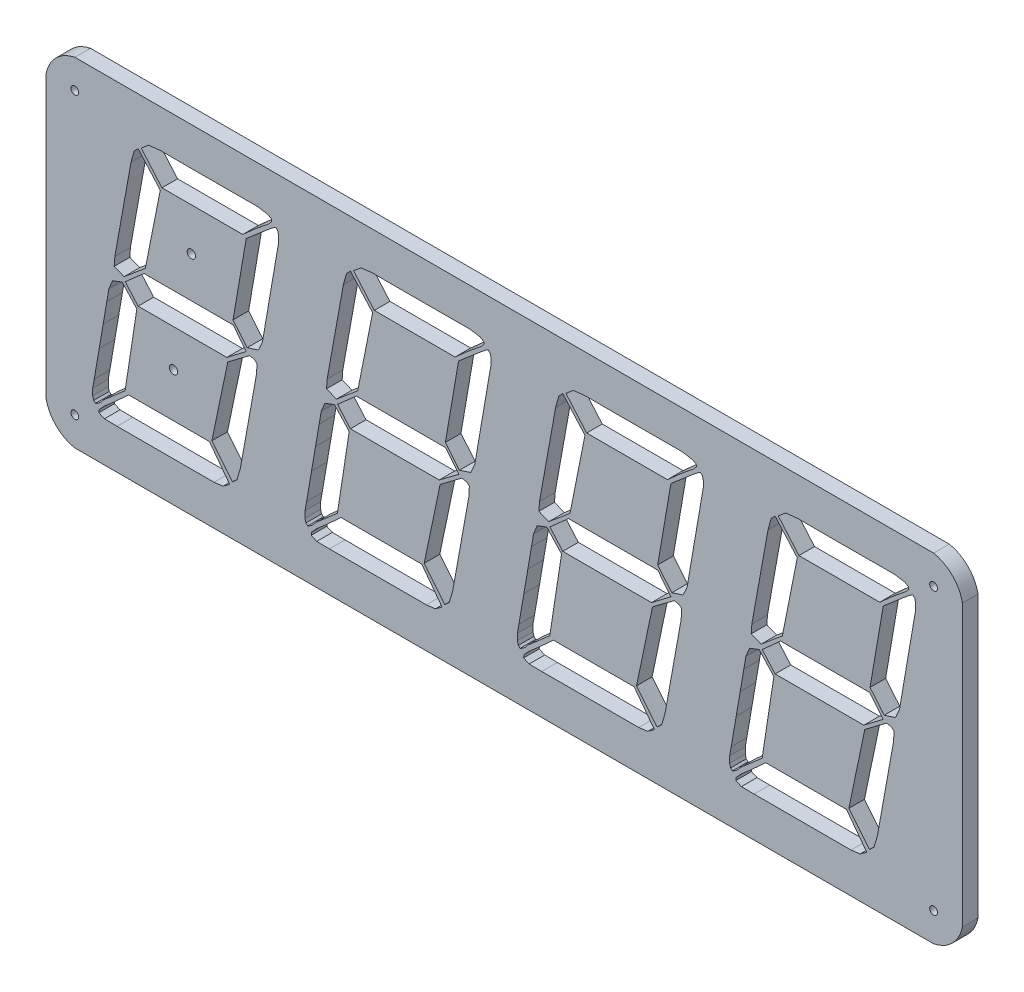
from build123d import *

# Parameters (mm, degrees)
MODEL_R                 = 1.5
MODEL_R_2               = 1.6
SALIENTE_EXTRUIR1_DEPTH = 6


with BuildPart() as part:
    # Model → Saliente-Extruir1 (new body)
    with BuildSketch(Plane.XY):
        with BuildLine():
            Line((-140.470724827, 55.674525344), (-140.470724827, -52.204727485))
            ThreePointArc((-140.470724827, -52.204727485), (-136.629245308, -59.423621552), (-129.410351241, -63.265101071))
            Line((-129.410351241, -63.265101071), (200.589648759, -63.265101071))
            ThreePointArc((200.589648759, -63.265101071), (207.808542826, -59.423621552), (211.650022344, -52.204727485))
            Line((211.650022344, -52.204727485), (211.650022344, 55.674525344))
            ThreePointArc((211.650022344, 55.674525344), (207.808542826, 62.893419411), (200.589648759, 66.734898929))
            Line((200.589648759, 66.734898929), (-129.410351241, 66.734898929))
            ThreePointArc((-129.410351241, 66.734898929), (-136.629245308, 62.893419411), (-140.470724827, 55.674525344))
        make_face()
        with Locations((-129.410351241, 55.674525344)):
            Circle(MODEL_R, mode=Mode.SUBTRACT)
        with Locations((-129.410351241, -52.232254112)):
            Circle(MODEL_R, mode=Mode.SUBTRACT)
        with Locations((200.589648759, -52.204727485)):
            Circle(MODEL_R, mode=Mode.SUBTRACT)
        with Locations((200.589648759, 55.674525344)):
            Circle(MODEL_R, mode=Mode.SUBTRACT)
        with Locations((-84.621427726, 23.674258093)):
            Circle(MODEL_R_2, mode=Mode.SUBTRACT)
        with Locations((-91.444427726, -18.252741907)):
            Circle(MODEL_R_2, mode=Mode.SUBTRACT)
        Polygon((-64.884856959, 40.039011276), (-95.922770086, 40.039011276), (-103.882551193, 49.264679304), (-101.023876189, 51.671251765), (-96.284270287, 52.176739278), (-90.706581993, 52.127820067), (-81.403433396, 52.1176096), (-71.480295888, 52.136742459), (-59.257239103, 52.179772042), (-55.252662933, 51.53218883), (-53.813979507, 50.694888149), (-53.724588788, 49.868123517), (-54.947078228, 48.507701415), (-60.024422271, 44.366939193), align=None, mode=Mode.SUBTRACT)
        Polygon((-110.03300778, 1.734898929), (-102.814876765, 8.071671701), (-68.533725838, 8.071671701), (-63.540735963, 1.734898929), (-70.992843615, -3.931820568), (-105.087782834, -3.931820568), align=None, mode=Mode.SUBTRACT)
        Polygon((-108.707083368, -35.279682173), (-77.669170242, -35.279682173), (-69.872498512, -45.652948091), (-72.416502607, -47.498902727), (-75.901031494, -47.942078344), (-113.168239594, -47.942078344), (-118.036746769, -47.892531747), (-120.137002167, -46.912762987), (-119.999276772, -45.742793724), (-117.901802063, -43.53971815), (-113.898335833, -40.046067211), align=None, mode=Mode.SUBTRACT)
        Polygon((-55.670106882, 46.108178554), (-63.540735963, 39.354819722), (-68.606058363, 9.737453244), (-63.184678555, 3.194264957), (-58.853820987, 4.586733548), (-57.298094034, 8.008171222), (-56.51592389, 12.618451892), (-55.116410552, 20.795833647), (-53.583708167, 29.72334992), (-51.669865847, 40.853005129), (-51.072887963, 44.202500304), (-51.088184118, 46.656502282), (-51.44120689, 48.048876852), (-52.14239582, 48.673896881), (-52.252566876, 48.664679591), (-52.375362447, 48.620233586), (-52.673945278, 48.459434843), (-53.460014826, 47.91262945), align=None, mode=Mode.SUBTRACT)
        Polygon((-105.072012462, 48.507701415), (-96.56147018, 38.907183759), (-102.29703342, 10.046188617), (-110.466659069, 3.194264957), (-114.26667157, 4.742709813), (-114.019879309, 8.131907993), (-107.806921005, 42.622319635), (-106.602545086, 46.96416624), align=None, mode=Mode.SUBTRACT)
        with BuildLine():
            Line((-118.525960031, -41.898386284), (-110.079105793, -34.563949873))
            Line((-110.079105793, -34.563949873), (-105.563926779, -5.130368892))
            Line((-105.563926779, -5.130368892), (-111.206650734, 1.026445264))
            Line((-111.206650734, 1.026445264), (-114.913623693, -0.375805811))
            Line((-114.913623693, -0.375805811), (-116.319894791, -3.799592058))
            Line((-116.319894791, -3.799592058), (-117.101955546, -8.409967835))
            Line((-117.101955546, -8.409967835), (-118.501040901, -16.587634913))
            Line((-118.501040901, -16.587634913), (-120.03320685, -25.515508809))
            Line((-120.03320685, -25.515508809), (-121.946275234, -36.64563907))
            Line((-121.946275234, -36.64563907), (-122.545270973, -39.993857087))
            Line((-122.545270973, -39.993857087), (-122.530400753, -42.447923117))
            Line((-122.530400753, -42.447923117), (-122.176472316, -43.840799855))
            Line((-122.176472316, -43.840799855), (-121.475626278, -44.465317717))
            ThreePointArc((-121.475626278, -44.465317717), (-119.808869122, -43.402392305), (-118.525960031, -41.898386284))
        make_face(mode=Mode.SUBTRACT)
        Polygon((-68.846147443, -44.329468953), (-76.745996886, -34.561523663), (-70.628911938, -5.255318769), (-62.274247408, 1.014314208), (-60.444587216, 0.705635699), (-59.388882074, -0.220399828), (-59.599355895, -3.924541934), (-65.812110901, -38.414366086), (-67.110061355, -42.765832133), align=None, mode=Mode.SUBTRACT)
        Polygon((16.706648759, 40.039011276), (-14.331264368, 40.039011276), (-22.291049361, 49.264679304), (-19.432370471, 51.671251765), (-14.692768455, 52.176739278), (-9.115076275, 52.127820067), (0.188072322, 52.1176096), (10.11120983, 52.136742459), (22.334232926, 52.179772042), (26.338842785, 51.53218883), (27.777526211, 50.694888149), (27.86691693, 49.868123517), (26.644408703, 48.507701415), (21.567083447, 44.366939193), align=None, mode=Mode.SUBTRACT)
        Polygon((-28.441502062, 1.734898929), (-21.223371047, 8.071671701), (13.05777988, 8.071671701), (18.174375425, 1.734898929), (10.598662103, -3.931820568), (-23.496277116, -3.931820568), align=None, mode=Mode.SUBTRACT)
        Polygon((-27.11557765, -35.279682173), (3.922335476, -35.279682173), (11.718958616, -45.652948091), (9.17500311, -47.498902727), (5.69043681, -47.942078344), (-31.576752663, -47.942078344), (-36.445241051, -47.892531747), (-38.545496449, -46.912762987), (-38.407771054, -45.742793724), (-36.31028533, -43.53971815), (-32.306830115, -40.046067211), align=None, mode=Mode.SUBTRACT)
        Polygon((25.921398836, 46.139928793), (18.050769755, 39.386569962), (12.985447355, 9.769203483), (18.406808376, 3.226015197), (22.737684731, 4.618483788), (24.293407798, 8.039921462), (25.075581828, 12.650202131), (26.475095166, 20.827583886), (28.007797551, 29.755100159), (29.921606183, 40.884755368), (30.518617755, 44.234250543), (30.503287911, 46.688252521), (30.150298828, 48.080627092), (29.449109898, 48.70564712), (29.338938842, 48.696429831), (29.216143271, 48.651983825), (28.91756044, 48.491185083), (28.131490892, 47.94437969), align=None, mode=Mode.SUBTRACT)
        Polygon((-23.480506744, 48.539451654), (-14.969964462, 38.938933998), (-20.705527702, 10.077938857), (-28.875187039, 3.226015197), (-32.675165852, 4.774460053), (-32.428373591, 8.163658232), (-26.215448976, 42.654069874), (-25.011039368, 46.995916479), align=None, mode=Mode.SUBTRACT)
        with BuildLine():
            Line((-36.934454313, -41.866636044), (-28.487600075, -34.532199634))
            Line((-28.487600075, -34.532199634), (-23.972421061, -5.098618653))
            Line((-23.972421061, -5.098618653), (-29.615178704, 1.058195503))
            Line((-29.615178704, 1.058195503), (-33.322117975, -0.344055572))
            Line((-33.322117975, -0.344055572), (-34.72840786, -3.767841819))
            Line((-34.72840786, -3.767841819), (-35.510449828, -8.378217596))
            Line((-35.510449828, -8.378217596), (-36.909535183, -16.555884673))
            Line((-36.909535183, -16.555884673), (-38.441701133, -25.48375857))
            Line((-38.441701133, -25.48375857), (-40.354788303, -36.613888831))
            Line((-40.354788303, -36.613888831), (-40.953765255, -39.962106848))
            Line((-40.953765255, -39.962106848), (-40.938913822, -42.416172877))
            Line((-40.938913822, -42.416172877), (-40.584966598, -43.809049616))
            Line((-40.584966598, -43.809049616), (-39.88412056, -44.433567477))
            ThreePointArc((-39.88412056, -44.433567477), (-38.21734434, -43.370663971), (-36.934454313, -41.866636044))
        make_face(mode=Mode.SUBTRACT)
        Polygon((12.745358275, -44.297718714), (4.845508832, -34.529773423), (10.96259378, -5.223568529), (19.317239523, 1.046064447), (21.146918502, 0.737385938), (22.202623644, -0.188649588), (21.992149824, -3.892791695), (15.779331327, -38.382615847), (14.481444363, -42.734081894), align=None, mode=Mode.SUBTRACT)
        Polygon((98.298154477, 40.039011276), (67.26024135, 40.039011276), (59.300422668, 49.264679304), (62.159135247, 51.671251765), (66.898703575, 52.176739278), (72.476429443, 52.127820067), (81.77957804, 52.1176096), (91.702715548, 52.136742459), (103.925704956, 52.179772042), (107.930348503, 51.53218883), (109.369031929, 50.694888149), (109.458422648, 49.868123517), (108.235895634, 48.507701415), (103.158589165, 44.366939193), align=None, mode=Mode.SUBTRACT)
        Polygon((53.150003656, 1.734898929), (60.295802146, 8.071671701), (94.576953073, 8.071671701), (99.642275473, 1.734898929), (92.190167821, -3.931820568), (58.095228602, -3.931820568), align=None, mode=Mode.SUBTRACT)
        Polygon((54.475928068, -35.279682173), (85.513841194, -35.279682173), (93.310415745, -45.652948091), (90.766508828, -47.498902727), (87.281942368, -47.942078344), (50.014704466, -47.942078344), (45.146264667, -47.892531747), (43.046009269, -46.912762987), (43.183734664, -45.742793724), (45.281171799, -43.53971815), (49.284675603, -40.046067211), align=None, mode=Mode.SUBTRACT)
        Polygon((107.512904554, 46.171679033), (99.642275473, 39.418320202), (94.576953073, 9.800953723), (99.998295307, 3.257765436), (104.329190448, 4.650234027), (105.88490963, 8.071671701), (106.667087545, 12.681952371), (108.066600884, 20.859334126), (109.599303269, 29.786850399), (111.513078213, 40.916505608), (112.110123473, 44.266000783), (112.094759941, 46.720002761), (111.741804546, 48.112377331), (111.040615616, 48.73739736), (110.93044456, 48.728180071), (110.807648989, 48.683734065), (110.509066158, 48.522935322), (109.72299661, 47.976129929), align=None, mode=Mode.SUBTRACT)
        Polygon((58.110998974, 48.571201894), (66.621541256, 38.970684238), (60.885978016, 10.109689096), (52.716314793, 3.257765436), (48.916339866, 4.806210292), (49.163132127, 8.195408472), (55.376023054, 42.685820114), (56.58046635, 47.027666719), align=None, mode=Mode.SUBTRACT)
        with BuildLine():
            Line((44.657051405, -41.834885805), (53.103905643, -34.500449394))
            Line((53.103905643, -34.500449394), (57.619084657, -5.066868414))
            Line((57.619084657, -5.066868414), (51.976323128, 1.089945743))
            Line((51.976323128, 1.089945743), (48.269387743, -0.312305332))
            Line((48.269387743, -0.312305332), (46.863079071, -3.736091579))
            Line((46.863079071, -3.736091579), (46.08105589, -8.346467356))
            Line((46.08105589, -8.346467356), (44.681970535, -16.524134433))
            Line((44.681970535, -16.524134433), (43.149804585, -25.45200833))
            Line((43.149804585, -25.45200833), (41.236698627, -36.582138591))
            Line((41.236698627, -36.582138591), (40.637740463, -39.930356608))
            Line((40.637740463, -39.930356608), (40.652573109, -42.384422638))
            Line((40.652573109, -42.384422638), (41.00653912, -43.777299376))
            Line((41.00653912, -43.777299376), (41.707385158, -44.401817238))
            ThreePointArc((41.707385158, -44.401817238), (43.374168747, -43.338922201), (44.657051405, -41.834885805))
        make_face(mode=Mode.SUBTRACT)
        Polygon((94.336863993, -44.265968474), (86.43701455, -34.498023184), (92.554099498, -5.19181829), (100.908756256, 1.077814687), (102.73842422, 0.769136178), (103.794129362, -0.156899349), (103.583655541, -3.861041455), (97.370803356, -38.350865607), (96.072950081, -42.702331654), align=None, mode=Mode.SUBTRACT)
        Polygon((179.889660195, 40.039011276), (148.851747068, 40.039011276), (140.891909599, 49.264679304), (143.750640965, 51.671251765), (148.490190506, 52.176739278), (154.067935161, 52.127820067), (163.371083758, 52.1176096), (173.294221266, 52.136742459), (185.517191887, 52.179772042), (189.521854221, 51.53218883), (190.960537647, 50.694888149), (191.049928366, 49.868123517), (189.82732296, 48.507701415), (184.750094883, 44.366939193), align=None, mode=Mode.SUBTRACT)
        Polygon((134.741509373, 1.734898929), (141.803205417, 8.071671701), (176.084356344, 8.071671701), (181.233781191, 1.734898929), (173.781673539, -3.931820568), (139.68673432, -3.931820568), align=None, mode=Mode.SUBTRACT)
        Polygon((136.067433786, -35.279682173), (167.105346912, -35.279682173), (174.90196228, -45.652948091), (172.358014546, -47.498902727), (168.873429298, -47.942078344), (131.606221199, -47.942078344), (126.737770385, -47.892531747), (124.637514987, -46.912762987), (124.775240381, -45.742793724), (126.87265873, -43.53971815), (130.87618132, -40.046067211), align=None, mode=Mode.SUBTRACT)
        Polygon((189.104410272, 46.203429272), (181.233781191, 39.450070441), (176.168458791, 9.832703962), (181.589722633, 3.289515675), (185.920696166, 4.681984267), (187.476396561, 8.103421941), (188.258593263, 12.71370261), (189.658106602, 20.891084365), (191.190808987, 29.818600639), (193.104624748, 40.948255847), (193.701629191, 44.297751022), (193.686246872, 46.751753), (193.333310264, 48.144127571), (192.632121334, 48.769147599), (192.521950278, 48.75993031), (192.399154707, 48.715484304), (192.100571876, 48.554685562), (191.314502328, 48.007880169), align=None, mode=Mode.SUBTRACT)
        Polygon((139.702504692, 48.602952133), (148.213046974, 39.002434477), (142.477483734, 10.141439336), (134.307742119, 3.289515675), (130.507845584, 4.837960532), (130.754637845, 8.227158711), (136.967539787, 42.717570353), (138.171972068, 47.059416958), align=None, mode=Mode.SUBTRACT)
        with BuildLine():
            Line((126.248557123, -41.803135565), (134.695411361, -34.468699155))
            Line((134.695411361, -34.468699155), (139.210590375, -5.035118174))
            Line((139.210590375, -5.035118174), (133.567810059, 1.121695982))
            Line((133.567810059, 1.121695982), (129.86089346, -0.280555093))
            Line((129.86089346, -0.280555093), (128.454566002, -3.70434134))
            Line((128.454566002, -3.70434134), (127.672561608, -8.314717117))
            Line((127.672561608, -8.314717117), (126.273476253, -16.492384194))
            Line((126.273476253, -16.492384194), (124.741310303, -25.420258091))
            Line((124.741310303, -25.420258091), (122.828185558, -36.550388352))
            Line((122.828185558, -36.550388352), (122.229246181, -39.898606369))
            Line((122.229246181, -39.898606369), (122.244060039, -42.352672398))
            Line((122.244060039, -42.352672398), (122.598044838, -43.745549137))
            Line((122.598044838, -43.745549137), (123.298890876, -44.370066998))
            ThreePointArc((123.298890876, -44.370066998), (124.965670144, -43.307166996), (126.248557123, -41.803135565))
        make_face(mode=Mode.SUBTRACT)
        Polygon((175.928369711, -44.234218235), (168.028520268, -34.466272944), (174.145605216, -5.16006805), (182.500243187, 1.109564926), (184.329929938, 0.800886417), (185.38563508, -0.125149109), (185.175161259, -3.829291216), (178.962230682, -38.319115368), (177.664455799, -42.670581415), align=None, mode=Mode.SUBTRACT)
    extrude(amount=SALIENTE_EXTRUIR1_DEPTH)


solid = part.part
